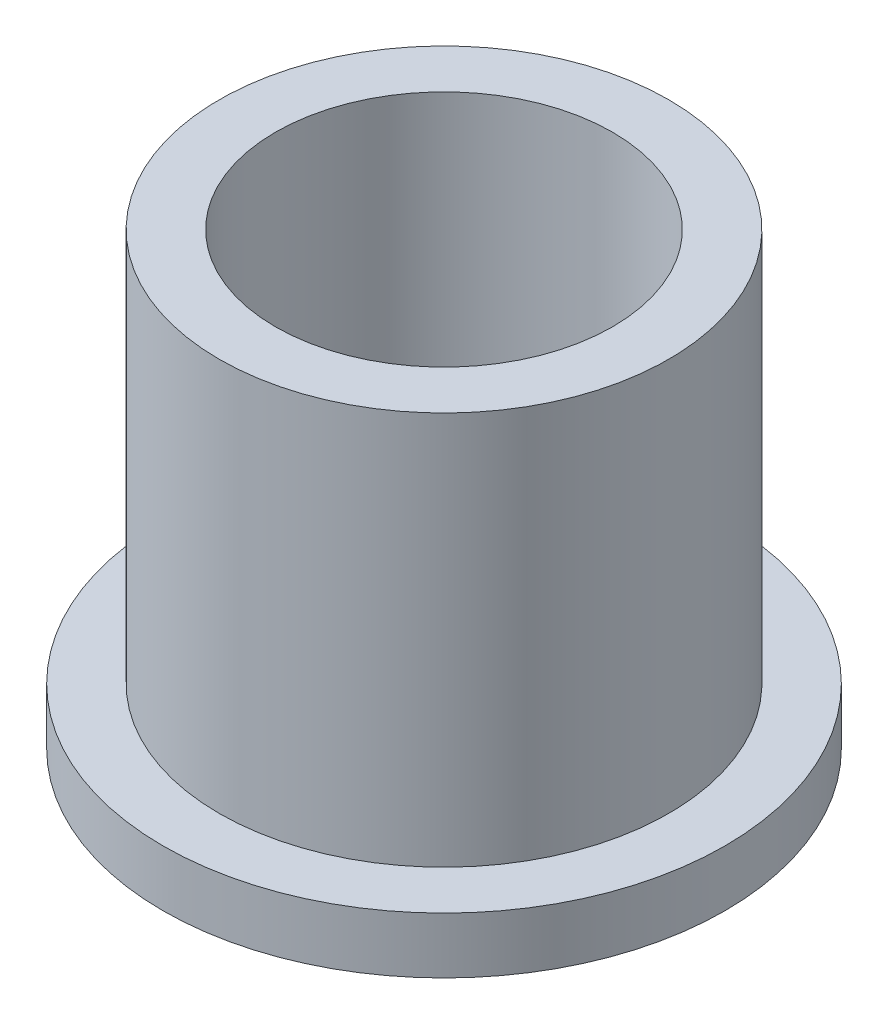
from build123d import *

# Parameters (mm, degrees)
SKETCH2_R           = 6.35
SKETCH2_R_2         = 4.7625
BOSS_EXTRUDE1_DEPTH = 12.7
SKETCH3_R           = 7.9375
SKETCH3_R_2         = 6.35
BOSS_EXTRUDE2_DEPTH = 1.5875


with BuildPart() as part:
    # Sketch2 → Boss-Extrude1 (new body)
    with BuildSketch(Plane(origin=(0, 0, 0), x_dir=(1, 0, 0), z_dir=(0, 1, 0))):
        with Locations(Location((0, 0, 0), (0, 0, 270))):
            Circle(SKETCH2_R)
        with Locations(Location((0, 0, 0), (0, 0, 270))):
            Circle(SKETCH2_R_2, mode=Mode.SUBTRACT)
    extrude(amount=BOSS_EXTRUDE1_DEPTH)

    # Sketch3 → Boss-Extrude2 (add)
    with BuildSketch(Plane(origin=(0, 0, 0), x_dir=(1, 0, 0), z_dir=(0, 1, 0))):
        with Locations(Location((0, 0, 0), (0, 0, 270))):
            Circle(SKETCH3_R)
        with Locations(Location((0, 0, 0), (0, 0, 270))):
            Circle(SKETCH3_R_2, mode=Mode.SUBTRACT)
    extrude(amount=BOSS_EXTRUDE2_DEPTH)


solid = part.part
